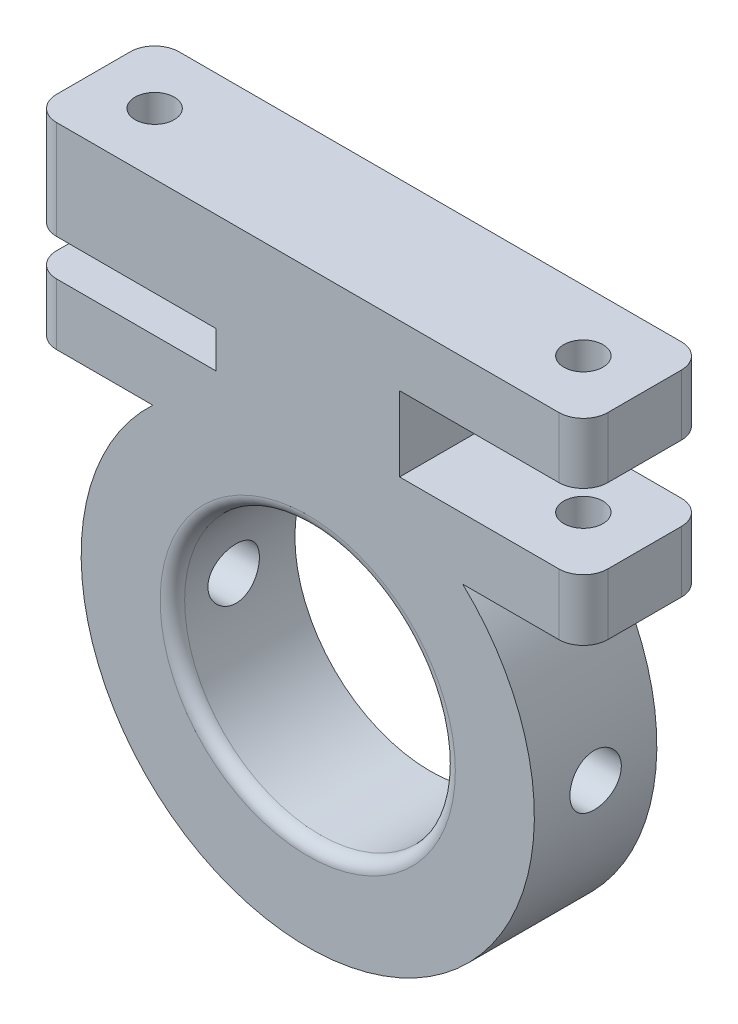
from build123d import *

# Parameters (mm, degrees)
CROQUIS1_W                 = 7.5
CROQUIS1_H                 = 6.1
SALIENTE_EXTRUIR2_DEPTH    = 5
CROQUIS2_R                 = 1.6
CORTAR_EXTRUIR1_DEPTH      = 18
REDONDEO1_R                = 1
CORTAR_EXTRUIR2_DEPTH      = 38.482562804
CORTAR_EXTRUIR2_DEPTH_BACK = 38.482562804
CROQUIS3_R                 = 2.1
REDONDEO2_R                = 2


with BuildPart() as part:
    # Croquis1 → Saliente-Extruir2 (new, symmetric)
    # profile 1 of 8: a face of its own
    with BuildSketch(Plane.XY):
        with BuildLine():
            ThreePointArc((12.649110641, 13.5), (6.800735254, 17.204650534), (-1e-09, 18.5))
            ThreePointArc((-1e-09, 18.5), (-6.800735255, 17.204650534), (-12.649110641, 13.5))
            ThreePointArc((-12.649110641, 13.5), (-7.356679045, -16.974371076), (18.5, 0))
            ThreePointArc((18.5, 0), (16.974371076, 7.356679045), (12.649110641, 13.5))
        make_face()
        with BuildLine():
            ThreePointArc((11.05, 0), (-7.813529932, -7.813529932), (0, 11.05))
            ThreePointArc((0, 11.05), (7.813529932, 7.813529932), (11.05, 0))
        make_face(mode=Mode.SUBTRACT)
    # profile 2 of 8: a face of its own
    with BuildSketch(Plane.XY):
        with BuildLine():
            ThreePointArc((12.649110641, 13.5), (6.800735254, 17.204650534), (-1e-09, 18.5))
            ThreePointArc((-1e-09, 18.5), (-6.800735255, 17.204650534), (-12.649110641, 13.5))
            ThreePointArc((-12.649110641, 13.5), (-7.356679045, -16.974371076), (18.5, 0))
            ThreePointArc((18.5, 0), (16.974371076, 7.356679045), (12.649110641, 13.5))
        make_face()
        with BuildLine():
            ThreePointArc((11.05, 0), (-7.813529932, -7.813529932), (0, 11.05))
            ThreePointArc((0, 11.05), (7.813529932, 7.813529932), (11.05, 0))
        make_face(mode=Mode.SUBTRACT)
    # profile 3 of 8: a face of its own
    with BuildSketch(Plane.XY):
        with BuildLine():
            Line((7.5, 18.5), (-1e-09, 18.5))
            ThreePointArc((-1e-09, 18.5), (6.800735254, 17.204650534), (12.649110641, 13.5))
            Line((12.649110641, 13.5), (22.5, 13.5))
            Line((22.5, 13.5), (22.5, 18.5))
            Line((22.5, 18.5), (7.5, 18.5))
        make_face()
    # profile 4 of 8: a face of its own
    with BuildSketch(Plane.XY):
        with BuildLine():
            Line((-7.5, 18.5), (-22.5, 18.5))
            Line((-22.5, 18.5), (-22.5, 13.5))
            Line((-22.5, 13.5), (-12.649110641, 13.5))
            ThreePointArc((-12.649110641, 13.5), (-6.800735255, 17.204650534), (-1e-09, 18.5))
            Line((-1e-09, 18.5), (-7.5, 18.5))
        make_face()
    # profile 5 of 8: a face of its own
    with BuildSketch(Plane.XY):
        Polygon((-22.5, 21.5), (-7.5, 21.5), (-7.5, 24.6), (0, 24.6), (0, 29.558290112), (-22.5, 29.558290112), (-22.5, 24.558290112), align=None)
    # profile 6 of 8: a face of its own
    with BuildSketch(Plane.XY):
        with Locations((3.75, 21.55)):
            Rectangle(CROQUIS1_W, CROQUIS1_H)
    # profile 7 of 8: a face of its own
    with BuildSketch(Plane.XY):
        Polygon((-7.5, 21.5), (-7.5, 18.5), (-1e-09, 18.5), (0, 24.6), (-7.5, 24.6), align=None)
    # profile 8 of 8: a face of its own
    with BuildSketch(Plane.XY):
        Polygon((0, 29.558290112), (0, 24.6), (7.5, 24.6), (22.5, 24.6), (22.5, 29.558290112), align=None)
    extrude(amount=SALIENTE_EXTRUIR2_DEPTH, both=True)

    # Croquis2 → Cortar-Extruir1 (cut)
    with BuildSketch(Plane(origin=(0, 29.558290112, 0), x_dir=(1, 0, 0), z_dir=(0, 1, 0))):
        with Locations(Location((-17.5, 0, 0), (0, 0, 270))):
            Circle(CROQUIS2_R)
        with Locations(Location((17.5, 0, 0), (0, 0, 270))):
            Circle(CROQUIS2_R)
    extrude(amount=-CORTAR_EXTRUIR1_DEPTH, mode=Mode.SUBTRACT)

    # Redondeo1
    redondeo1_edges = [part.edges().sort_by_distance(p)[0] for p in [
        (7.813529932, 7.813529932, 5),
    ]]
    fillet(redondeo1_edges, radius=REDONDEO1_R)

    # Croquis3 → Cortar-Extruir2 (cut, two sides: drawn at the far end of the back side and taken through both)
    with BuildSketch(Plane(origin=(0, 0, 0), x_dir=(0, 0, -1), z_dir=(1, 0, 0)).offset(-CORTAR_EXTRUIR2_DEPTH_BACK)):
        Circle(CROQUIS3_R)
    extrude(amount=CORTAR_EXTRUIR2_DEPTH + CORTAR_EXTRUIR2_DEPTH_BACK, mode=Mode.SUBTRACT)

    # Redondeo2
    redondeo2_edges = [part.edges().sort_by_distance(p)[0] for p in [
        (22.5, 16, -5),
        (-22.5, 16, -5),
        (-22.5, 25.529145056, -5),
        (22.5, 27.079145056, 5),
        (22.5, 27.079145056, -5),
        (-22.5, 25.529145056, 5),
        (-22.5, 16, 5),
        (22.5, 16, 5),
    ]]
    fillet(redondeo2_edges, radius=REDONDEO2_R)


solid = part.part
